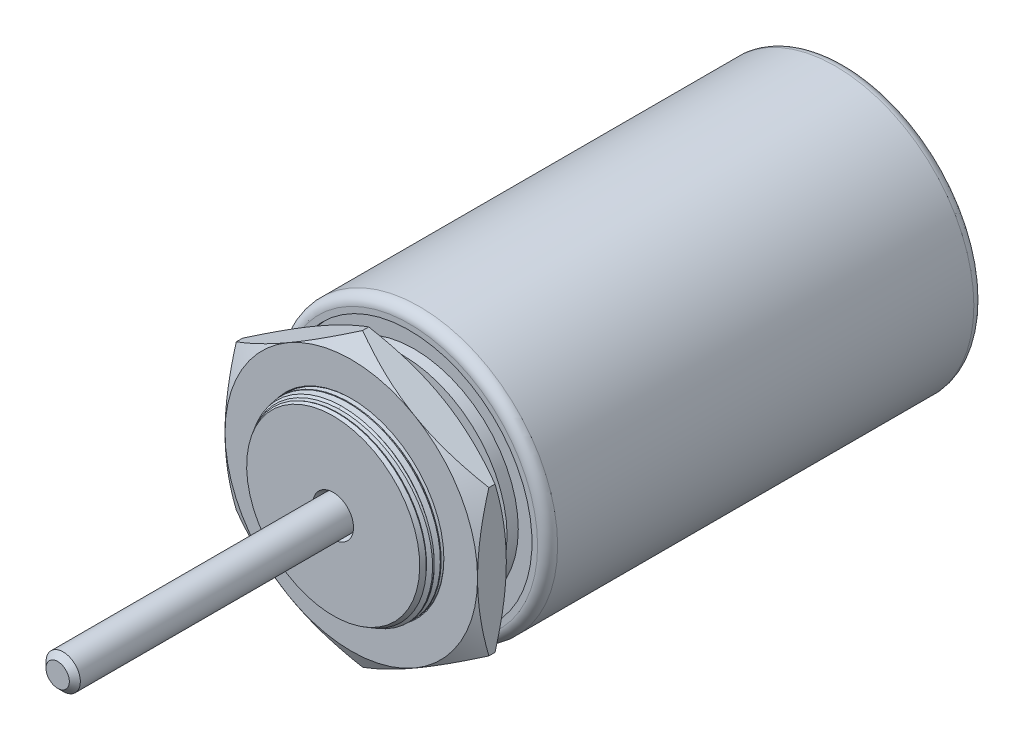
from build123d import *

# Parameters (mm, degrees)
CUT_SWEEP1_PITCH       = 0.940740741
CUT_SWEEP1_HEIGHT      = 9.043340741
CUT_SWEEP1_RADIUS      = 12.7
CUT_SWEEP1_START_ANGLE = 90
BOSS_EXTRUDE3_START    = 3.175
SKETCH10_R             = 12.7
BOSS_EXTRUDE3_DEPTH    = 3.96875


with BuildPart() as part:
    # Sketch1 → Revolve1 (revolve)
    with BuildSketch(Plane(origin=(0, 0, 0), x_dir=(0, 0, -1), z_dir=(1, 0, 0)), mode=Mode.PRIVATE) as revolve1_sk:
        with BuildLine():
            Line((59.8297, 19.1135), (2.2733, 19.1135))
            ThreePointArc((2.2733, 19.1135), (1.294452083, 18.708047917), (0.889, 17.7292))
            Line((0.889, 17.7292), (0.889, 16.95069))
            Line((0.889, 16.95069), (1.5494, 16.95069))
            Line((1.5494, 16.95069), (1.5494, 14.39672))
            Line((1.5494, 14.39672), (0, 14.39672))
            Line((0, 14.39672), (0, 6.35))
            Line((0, 6.35), (61.214, 6.35))
            Line((61.214, 6.35), (61.214, 17.7292))
            ThreePointArc((61.214, 17.7292), (60.808547917, 18.708047917), (59.8297, 19.1135))
        make_face()
    revolve(revolve1_sk.sketch.rotate(Axis((0, 0, -61.214), (0, 0, 1)), 90), axis=Axis((0, 0, -61.214), (0, 0, 1)))

    # Sketch2 → Revolve2 (revolve)
    with BuildSketch(Plane(origin=(0, 0, 0), x_dir=(0, 0, -1), z_dir=(1, 0, 0))):
        Polygon((-9.652, 2.814840905), (-9.652, 11.966765158), (-8.382, 12.7), (-3.2639, 12.7), (-1.5494, 10.9855), (0, 10.9855), (0, 2.3749), (-8.89, 2.3749), align=None)
    revolve(axis=Axis((0, 0, 0), (0, 0, 1)))

    # Cut-Sweep1: sweep along a helix
    with BuildLine() as cut_sweep1_path:
        add(Helix(CUT_SWEEP1_PITCH, CUT_SWEEP1_HEIGHT, CUT_SWEEP1_RADIUS, center=(0, 0, 9.652), direction=(0, 0, -1), mode=Mode.PRIVATE).rotate(Axis((0, 0, 9.652), (0, 0, -1)), CUT_SWEEP1_START_ANGLE))
    # Sketch7 → Cut-Sweep1 (sweep, cut)
    with BuildSketch(Plane(origin=(0, 0, 0), x_dir=(0, 0, -1), z_dir=(1, 0, 0))):
        Polygon((-10.12237037, 12.088970965), (-10.004777778, 12.088970965), (-9.622601852, 12.750919086), (-10.504546296, 12.750919086), align=None)
    sweep(path=cut_sweep1_path.line, is_frenet=True, mode=Mode.SUBTRACT)


with BuildPart() as body_2:
    # Sketch3 → Revolve3 (revolve)
    with BuildSketch(Plane(origin=(0, 0, 0), x_dir=(0, 0, -1), z_dir=(1, 0, 0))):
        Polygon((-46.99, 2.3749), (-47.752, 1.6129), (-47.752, 0), (70.2056, 0), (70.2056, 2.8575), (67.0306, 2.8575), (67.0306, 6.35), (3.9624, 6.35), (3.9624, 2.3749), align=None)
    revolve(axis=Axis((0, 0, -70.2056), (0, 0, 1)))


with BuildPart() as body_3:
    # Sketch10 → Boss-Extrude3 (new body)
    with BuildSketch(Plane.XY.offset(BOSS_EXTRUDE3_START)):
        Polygon((0, 20.163958151), (-17.4625, 10.081979076), (-17.4625, -10.081979076), (0, -20.163958151), (17.4625, -10.081979076), (17.4625, 10.081979076), align=None)
        Circle(SKETCH10_R, mode=Mode.SUBTRACT)
    extrude(amount=BOSS_EXTRUDE3_DEPTH)

    # Sketch11 → Cut-Revolve1 (revolve, cut)
    with BuildSketch(Plane(origin=(0, 0, 0), x_dir=(0, 0, -1), z_dir=(1, 0, 0))):
        Polygon((-7.14375, 20.163958151), (-7.14375, 17.4625), (-5.584062409, 20.163958151), align=None)
        Polygon((-3.175, 20.163958151), (-3.175, 17.4625), (-4.734687591, 20.163958151), align=None)
        Polygon((-7.14375, 12.801838172), (-7.14375, 12.7), (-7.041911828, 12.7), align=None)
        Polygon((-3.175, 12.801838172), (-3.175, 12.7), (-3.276838172, 12.7), align=None)
    revolve(axis=Axis((0, 0, 7.14375), (0, 0, -1)), mode=Mode.SUBTRACT)


solid = Compound([part.part, body_2.part, body_3.part])
